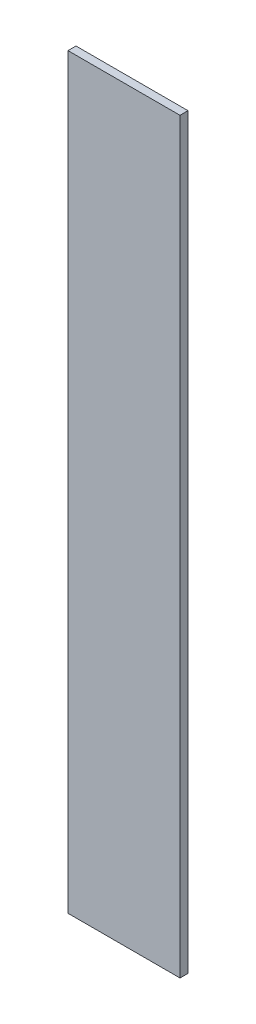
from build123d import *

# Parameters (mm, degrees)
SKETCH2_W           = 593.09
SKETCH2_H           = 88.9
BOSS_EXTRUDE1_DEPTH = 6.35


with BuildPart() as part:
    # Sketch2 → Boss-Extrude1 (new body)
    with BuildSketch(Plane(origin=(0, 0, 0), x_dir=(0, 1, 0), z_dir=(0, 0, 1))):
        with Locations((296.545, 44.45)):
            Rectangle(SKETCH2_W, SKETCH2_H)
    extrude(amount=BOSS_EXTRUDE1_DEPTH)


solid = part.part
